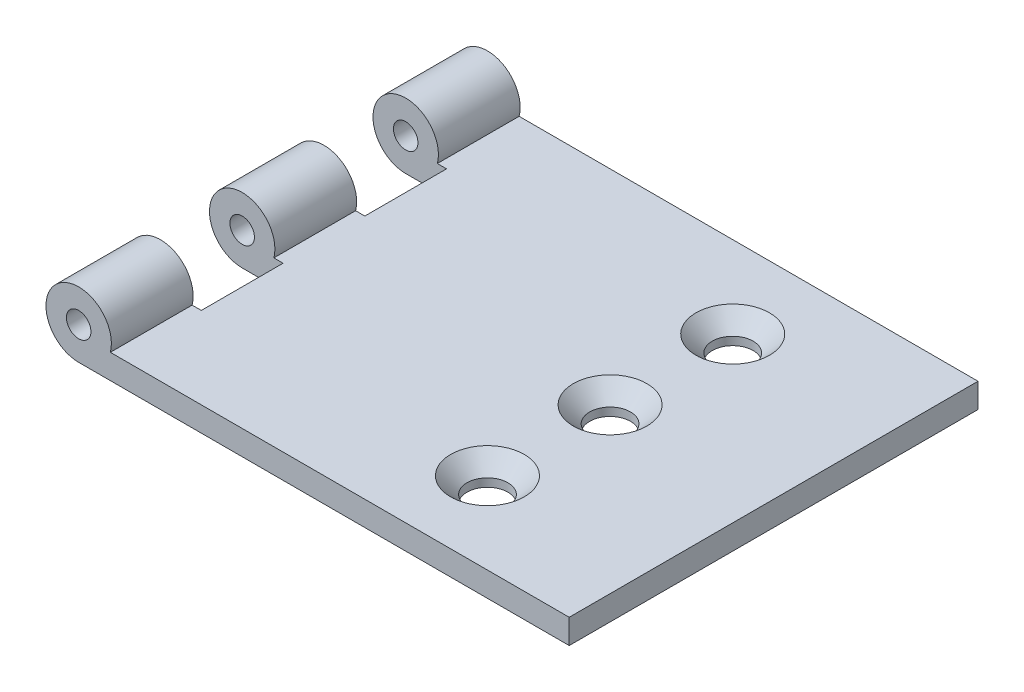
from build123d import *

# Parameters (mm, degrees)
EXTRUDE_1_DEPTH        = 3
SKETCH_2_R             = 4
EXTRUDE_2_DEPTH        = 10
PATTERN_LINEAR_1_COUNT = 3
PATTERN_LINEAR_1_PITCH = 20
SKETCH_3_R             = 1.5
CUT_EXTRUDE_1_DEPTH    = 65
SKETCH_4_R             = 2.5
CUT_EXTRUDE_2_DEPTH    = 66.192024052


with BuildPart() as part:
    # 草图1 → 凸台-拉伸1 (new body)
    with BuildSketch(Plane(origin=(0, 0, 0), x_dir=(1, 0, 0), z_dir=(0, 1, 0))):
        Polygon((0, 25), (60, 25), (60, -25), (0, -25), (0, -15), (5, -15), (5, -5), (0, -5), (0, 5), (5, 5), (5, 15), (0, 15), align=None)
    extrude(amount=EXTRUDE_1_DEPTH)

    # 草图2 → 凸台-拉伸2 (add)
    with BuildSketch(Plane.XY.offset(-25)):
        with Locations((0, 4)):
            Circle(SKETCH_2_R)
    extrude_2 = extrude(amount=EXTRUDE_2_DEPTH)

    # 阵列(线性)1: 凸台-拉伸2 ×3
    with Locations(*[(0, 0, i * PATTERN_LINEAR_1_PITCH) for i in range(1, PATTERN_LINEAR_1_COUNT)]):
        add(extrude_2)

    # 草图3 → 切除-拉伸1 (cut, symmetric)
    with BuildSketch(Plane.XY.offset(-25)):
        with Locations((0, 4)):
            Circle(SKETCH_3_R)
    extrude(amount=CUT_EXTRUDE_1_DEPTH, both=True, mode=Mode.SUBTRACT)

    # 草图4 → 切除-拉伸2 (cut, through all)
    with BuildSketch(Plane(origin=(0, 3, 0), x_dir=(1, 0, 0), z_dir=(0, 1, 0))):
        with Locations(Location((40, 15, 0), (0, 0, 270))):
            Circle(SKETCH_4_R)
        with Locations(Location((40, 0, 0), (0, 0, 270))):
            Circle(SKETCH_4_R)
        with Locations(Location((40, -15, 0), (0, 0, 270))):
            Circle(SKETCH_4_R)
    extrude(amount=-CUT_EXTRUDE_2_DEPTH, mode=Mode.SUBTRACT)

    # 草图10 → 切除-旋转1 (revolve, cut)
    with BuildSketch(Plane(origin=(40, 0, 0), x_dir=(0, 0, -1), z_dir=(1, 0, 0))):
        Polygon((12.5, 3), (10.5, 3), (12.5, 1), align=None)
    revolve(axis=Axis((40, 0, -15), (0, 1, 0)), mode=Mode.SUBTRACT)

    # 草图11 → 切除-旋转2 (revolve, cut)
    with BuildSketch(Plane(origin=(40, 0, 0), x_dir=(0, 0, -1), z_dir=(1, 0, 0))):
        Polygon((-2.5, 3), (-4.5, 3), (-2.5, 1), align=None)
    revolve(axis=Axis((40, 0, 0), (0, 1, 0)), mode=Mode.SUBTRACT)

    # 草图12 → 切除-旋转3 (revolve, cut)
    with BuildSketch(Plane(origin=(40, 0, 0), x_dir=(0, 0, -1), z_dir=(1, 0, 0))):
        Polygon((-17.5, 3), (-19.5, 3), (-17.5, 1), align=None)
    revolve(axis=Axis((40, 0, 15), (0, 1, 0)), mode=Mode.SUBTRACT)


solid = part.part
